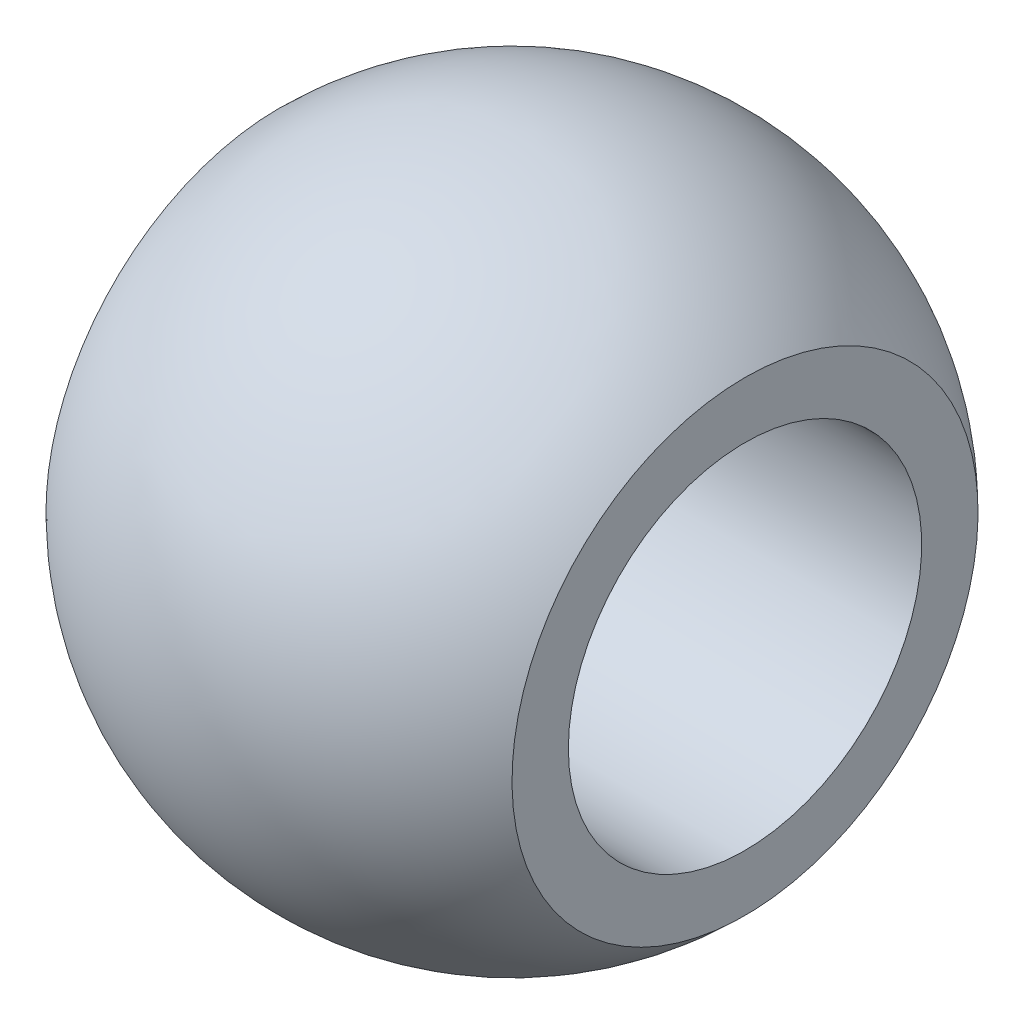
from build123d import *

# Parameters (mm, degrees)
SKETCH1_W = 9
SKETCH1_H = 1.088480949


with BuildPart() as part:
    # Sketch1 → Revolve1 (revolve)
    with BuildSketch(Plane.XY, mode=Mode.PRIVATE) as revolve1_sk:
        with Locations((0, -3.955759526)):
            Rectangle(SKETCH1_W, SKETCH1_H)
        with BuildLine():
            Line((4.5, -4.5), (-4.5, -4.5))
            ThreePointArc((-4.5, -4.5), (0, -6.363961031), (4.5, -4.5))
        make_face()
        with BuildLine():
            ThreePointArc((4.5, 4.5), (0, 6.363961031), (-4.5, 4.5))
            Line((-4.5, 4.5), (4.5, 4.5))
        make_face()
        with Locations((0, 3.955759526)):
            Rectangle(SKETCH1_W, SKETCH1_H)
    revolve(revolve1_sk.sketch.rotate(Axis((-15.215278476, 0, 0), (1, 0, 0)), 270), axis=Axis((-15.215278476, 0, 0), (1, 0, 0)))


solid = part.part
